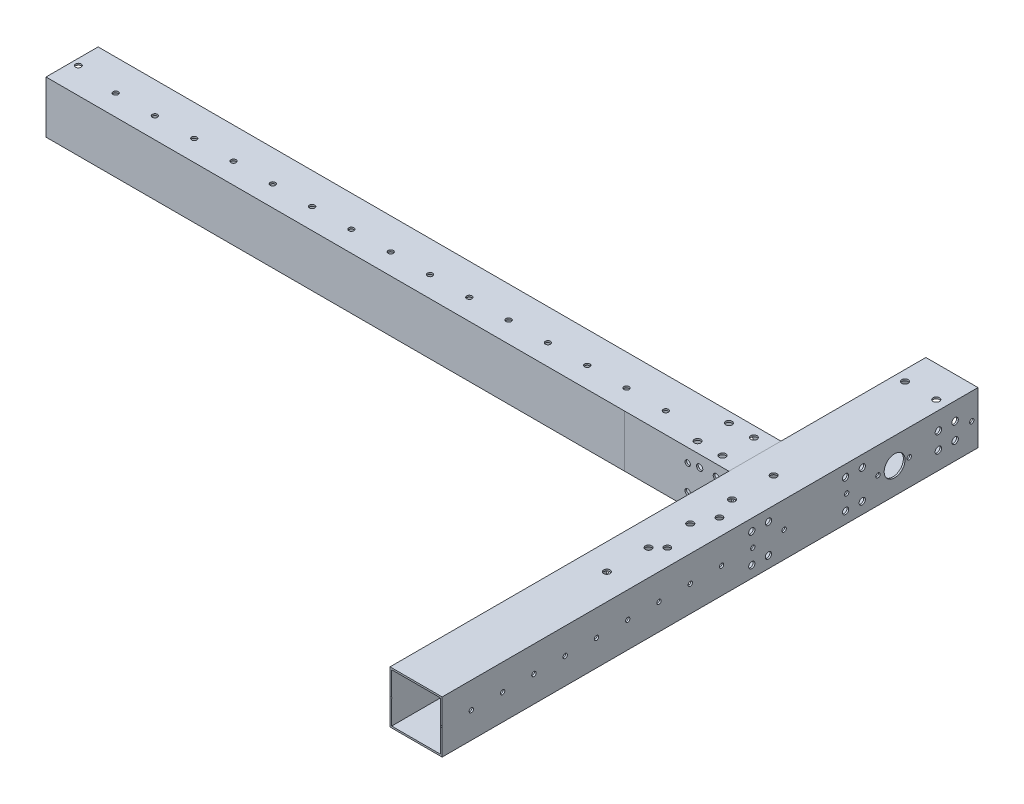
from build123d import *

# Parameters (mm, degrees)
F_20X20X1_1_DEPTH         = 340
F_20X20X1_1_DEPTH_BACK    = 1
SKETCH_1_W                = 25
SKETCH_1_H                = 25
SKETCH_1_W_2              = 23.4
SKETCH_1_H_2              = 23.4
SKETCH_1_ON_SEGMENT_2_W   = 25
SKETCH_1_ON_SEGMENT_2_H   = 25
SKETCH_1_ON_SEGMENT_2_W_2 = 23.4
SKETCH_1_ON_SEGMENT_2_H_2 = 23.4
F_20X20X1_1_2_DEPTH       = 257
SKETCH_6_R                = 1.05
SKETCH_6_R_2              = 1.55
SKETCH_6_R_3              = 5
CUT_EXTRUDE_5_DEPTH       = 394.748015868
SKETCH_7_R                = 1.5
CUT_EXTRUDE_6_DEPTH       = 384.210125127
SKETCH_8_R                = 1.25
SKETCH_8_R_2              = 1.55
SKETCH_8_R_3              = 1.35
CUT_EXTRUDE_7_DEPTH       = 384.210125127
SKETCH_9_R                = 1.5
CUT_EXTRUDE_8_DEPTH       = 378.04442709
SKETCH_10_R               = 1.3
CUT_EXTRUDE_9_DEPTH       = 378.04442709
SKETCH_11_R               = 1.5
CUT_EXTRUDE_10_DEPTH      = 372.533982295
SKETCH_12_R               = 1.55
CUT_EXTRUDE_11_DEPTH      = 384.210125127
SKETCH_13_W               = 50
SKETCH_13_H               = 25
CUT_EXTRUDE_12_DEPTH      = 0.01


with BuildPart() as part:
    # 草图1 → 方形管 20X20X1(1) (new, two sides: drawn at the far end of the back side and taken through both)
    with BuildSketch(Plane.ZY.offset(-F_20X20X1_1_DEPTH_BACK)):
        Rectangle(SKETCH_1_W, SKETCH_1_H)
        Rectangle(SKETCH_1_W_2, SKETCH_1_H_2, mode=Mode.SUBTRACT)
    extrude(amount=F_20X20X1_1_DEPTH + F_20X20X1_1_DEPTH_BACK)

    # 方形管 20X20X1(1) end butt 1
    split(bisect_by=Plane(origin=(-12.5, 0, 0), x_dir=(0, -1, 0), z_dir=(-1, 0, 0)), keep=Keep.TOP)


with BuildPart() as body_2:
    # 草图1 on segment 2 (carried to segment 2) → 20X20X1_1 2 (new body)
    with BuildSketch(Plane.XY.offset(-82)):
        Rectangle(SKETCH_1_ON_SEGMENT_2_W, SKETCH_1_ON_SEGMENT_2_H)
        Rectangle(SKETCH_1_ON_SEGMENT_2_W_2, SKETCH_1_ON_SEGMENT_2_H_2, mode=Mode.SUBTRACT)
    extrude(amount=F_20X20X1_1_2_DEPTH)

    # 草图6 → 切除-拉伸5 (cut, through all)
    with BuildSketch(Plane(origin=(12.5, 0, 0), x_dir=(0, 0, -1), z_dir=(1, 0, 0))):
        with Locations((-236, 0)):
            Circle(SKETCH_6_R)
        with Locations((-221, 0)):
            Circle(SKETCH_6_R)
        with Locations((-206, 0)):
            Circle(SKETCH_6_R)
        with Locations((-191, 0)):
            Circle(SKETCH_6_R)
        with Locations((-176, 0)):
            Circle(SKETCH_6_R)
        with Locations(Location((-161, 0, 0), (0, 0, 90))):
            Circle(SKETCH_6_R)
        with Locations(Location((-146, 0, 0), (0, 0, 90))):
            Circle(SKETCH_6_R)
        with Locations(Location((-131, 0, 0), (0, 0, 90))):
            Circle(SKETCH_6_R)
        with Locations(Location((-116, 0, 0), (0, 0, 90))):
            Circle(SKETCH_6_R)
        with Locations(Location((-101, 0, 0), (0, 0, 90))):
            Circle(SKETCH_6_R)
        with Locations(Location((-86, 0, 0), (0, 0, 90))):
            Circle(SKETCH_6_R)
        with Locations(Location((-71, 0, 0), (0, 0, 90))):
            Circle(SKETCH_6_R)
        with Locations(Location((-56, 0, 0), (0, 0, 90))):
            Circle(SKETCH_6_R)
        with Locations(Location((-41, 0, 0), (0, 0, 90))):
            Circle(SKETCH_6_R)
        with Locations(Location((-26, 0, 0), (0, 0, 90))):
            Circle(SKETCH_6_R)
        with Locations(Location((-11, 0, 0), (0, 0, 90))):
            Circle(SKETCH_6_R)
        with Locations(Location((19, 0, 0), (0, 0, 90))):
            Circle(SKETCH_6_R)
        with Locations(Location((34, 0, 0), (0, 0, 90))):
            Circle(SKETCH_6_R)
        with Locations(Location((49, 0, 0), (0, 0, 90))):
            Circle(SKETCH_6_R)
        with Locations(Location((79, 0, 0), (0, 0, 90))):
            Circle(SKETCH_6_R)
        with Locations((94, 0)):
            Circle(SKETCH_6_R)
        with Locations((109, 0)):
            Circle(SKETCH_6_R)
        with Locations((124, 0)):
            Circle(SKETCH_6_R)
        with Locations((139, 0)):
            Circle(SKETCH_6_R)
        with Locations((154, 0)):
            Circle(SKETCH_6_R)
        with Locations((169, 0)):
            Circle(SKETCH_6_R)
        with Locations((-251, 0)):
            Circle(SKETCH_6_R)
        with Locations((-266, 0)):
            Circle(SKETCH_6_R)
        with Locations((-281, 0)):
            Circle(SKETCH_6_R)
        with Locations((-296, 0)):
            Circle(SKETCH_6_R)
        with Locations(Location((71, 4, 0), (0, 0, 90))):
            Circle(SKETCH_6_R_2)
        with Locations(Location((63, 4, 0), (0, 0, 90))):
            Circle(SKETCH_6_R_2)
        with Locations(Location((71, -4, 0), (0, 0, 270))):
            Circle(SKETCH_6_R_2)
        with Locations(Location((63, -4, 0), (0, 0, 270))):
            Circle(SKETCH_6_R_2)
        with Locations(Location((42, 0, 0), (0, 0, 90))):
            Circle(SKETCH_6_R_3)
    extrude(amount=-CUT_EXTRUDE_5_DEPTH, mode=Mode.SUBTRACT)

    # 草图7 → 切除-拉伸6 (cut, through all)
    with BuildSketch(Plane.XZ.offset(12.5)):
        with Locations(Location((4.5, 34, 0), (0, 0, 270))):
            Circle(SKETCH_7_R)
        with Locations(Location((4.5, 59, 0), (0, 0, 270))):
            Circle(SKETCH_7_R)
    extrude(amount=-CUT_EXTRUDE_6_DEPTH, mode=Mode.SUBTRACT)


with BuildPart() as cut_extrude_7_tool:
    # 草图8 → 切除-拉伸7 (new, through all)
    with BuildSketch(Plane(origin=(0, 12.5, 0), x_dir=(1, 0, 0), z_dir=(0, 1, 0))):
        with Locations(Location((-316.606166963, -2.5, 0), (0, 0, 270))):
            Circle(SKETCH_8_R)
        with Locations(Location((-297.756611042, -2.5, 0), (0, 0, 270))):
            Circle(SKETCH_8_R)
        with Locations(Location((-278.90705512, -2.5, 0), (0, 0, 270))):
            Circle(SKETCH_8_R)
        with Locations(Location((-260.057499199, -2.5, 0), (0, 0, 270))):
            Circle(SKETCH_8_R)
        with Locations(Location((-241.207943277, -2.5, 0), (0, 0, 270))):
            Circle(SKETCH_8_R)
        with Locations(Location((-222.358387356, -2.5, 0), (0, 0, 270))):
            Circle(SKETCH_8_R)
        with Locations(Location((-203.508831434, -2.5, 0), (0, 0, 270))):
            Circle(SKETCH_8_R)
        with Locations(Location((-184.659275512, -2.5, 0), (0, 0, 270))):
            Circle(SKETCH_8_R)
        with Locations(Location((-165.809719591, -2.5, 0), (0, 0, 270))):
            Circle(SKETCH_8_R)
        with Locations(Location((-146.960163669, -2.5, 0), (0, 0, 270))):
            Circle(SKETCH_8_R)
        with Locations(Location((-128.110607748, -2.5, 0), (0, 0, 270))):
            Circle(SKETCH_8_R)
        with Locations(Location((-71.561939983, -2.5, 0), (0, 0, 270))):
            Circle(SKETCH_8_R)
        with Locations(Location((-90.411495905, -2.5, 0), (0, 0, 270))):
            Circle(SKETCH_8_R)
        with Locations(Location((-109.261051826, -2.5, 0), (0, 0, 270))):
            Circle(SKETCH_8_R)
        with Locations(Location((-52.712384062, -2.5, 0), (0, 0, 270))):
            Circle(SKETCH_8_R)
        with Locations(Location((-32.5, 7.5, 0), (0, 0, 270))):
            Circle(SKETCH_8_R_2)
        with Locations(Location((-32.5, -7.5, 0), (0, 0, 270))):
            Circle(SKETCH_8_R_2)
        with Locations(Location((-20.5, 7.5, 0), (0, 0, 270))):
            Circle(SKETCH_8_R_2)
        with Locations(Location((-20.5, -7.5, 0), (0, 0, 270))):
            Circle(SKETCH_8_R_2)
        with Locations(Location((0, -83.5, 0), (0, 0, 270))):
            Circle(SKETCH_8_R_2)
        with Locations(Location((0, -63.5, 0), (0, 0, 270))):
            Circle(SKETCH_8_R_2)
        with Locations(Location((0, -43.5, 0), (0, 0, 270))):
            Circle(SKETCH_8_R_2)
        with Locations(Location((0, -23.5, 0), (0, 0, 270))):
            Circle(SKETCH_8_R_2)
        with Locations(Location((0, -3.5, 0), (0, 0, 270))):
            Circle(SKETCH_8_R_2)
        with Locations(Location((-337, 0, 0), (0, 0, 270))):
            Circle(SKETCH_8_R_3)
    extrude(amount=-CUT_EXTRUDE_7_DEPTH)


with BuildPart() as part_1:
    add(part.part)

    # 切除-拉伸7: cut by cut_extrude_7_tool
    add(cut_extrude_7_tool.part, mode=Mode.SUBTRACT)

    # 草图9 → 切除-拉伸8 (cut, through all)
    with BuildSketch(Plane.XY.offset(12.5)):
        with Locations((-18.5, 7)):
            Circle(SKETCH_9_R)
        with Locations((-18.5, -7)):
            Circle(SKETCH_9_R)
        with Locations((-26.5, -7)):
            Circle(SKETCH_9_R)
        with Locations((-26.5, 7)):
            Circle(SKETCH_9_R)
    extrude(amount=-CUT_EXTRUDE_8_DEPTH, mode=Mode.SUBTRACT)

    # 草图10 → 切除-拉伸9 (cut, through all)
    with BuildSketch(Plane.XY.offset(12.5)):
        with Locations((-32.25, 6)):
            Circle(SKETCH_10_R)
        with Locations((-32.25, -6)):
            Circle(SKETCH_10_R)
    extrude(amount=-CUT_EXTRUDE_9_DEPTH, mode=Mode.SUBTRACT)

    # 草图13 → 切除-拉伸12 (cut)
    with BuildSketch(Plane.XY.offset(12.5)):
        with Locations((-37.5, 0)):
            Rectangle(SKETCH_13_W, SKETCH_13_H)
    extrude(amount=-CUT_EXTRUDE_12_DEPTH, mode=Mode.SUBTRACT)


with BuildPart() as body_2_1:
    add(body_2.part)

    # 切除-拉伸7: cut by cut_extrude_7_tool
    add(cut_extrude_7_tool.part, mode=Mode.SUBTRACT)

    # 草图11 → 切除-拉伸10 (cut, through all)
    with BuildSketch(Plane.ZY.offset(12.5)):
        with Locations(Location((18.5, -7, 0), (0, 0, 270))):
            Circle(SKETCH_11_R)
        with Locations(Location((26.5, -7, 0), (0, 0, 270))):
            Circle(SKETCH_11_R)
        with Locations(Location((26.5, 7, 0), (0, 0, 270))):
            Circle(SKETCH_11_R)
        with Locations(Location((18.5, 7, 0), (0, 0, 270))):
            Circle(SKETCH_11_R)
        with Locations(Location((-26.5, -7, 0), (0, 0, 270))):
            Circle(SKETCH_11_R)
        with Locations(Location((-18.5, -7, 0), (0, 0, 270))):
            Circle(SKETCH_11_R)
        with Locations(Location((-18.5, 7, 0), (0, 0, 270))):
            Circle(SKETCH_11_R)
        with Locations(Location((-26.5, 7, 0), (0, 0, 270))):
            Circle(SKETCH_11_R)
    extrude(amount=-CUT_EXTRUDE_10_DEPTH, mode=Mode.SUBTRACT)

    # 草图12 → 切除-拉伸11 (cut, through all)
    with BuildSketch(Plane(origin=(0, 12.5, 0), x_dir=(1, 0, 0), z_dir=(0, 1, 0))):
        with Locations(Location((-7.5, 67, 0), (0, 0, 270))):
            Circle(SKETCH_12_R)
        with Locations(Location((7.5, 67, 0), (0, 0, 270))):
            Circle(SKETCH_12_R)
    extrude(amount=-CUT_EXTRUDE_11_DEPTH, mode=Mode.SUBTRACT)


solid = Compound([part_1.part, body_2_1.part])
